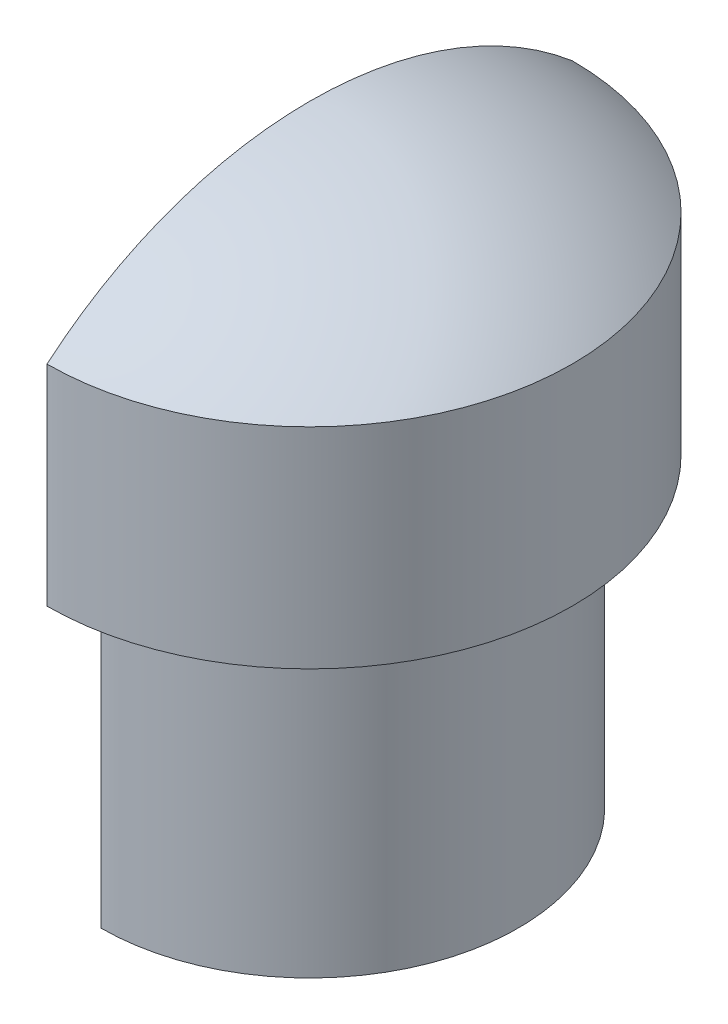
from build123d import *

# Parameters (mm, degrees)
SKETCH1_R           = 2.9
BOSS_EXTRUDE1_DEPTH = 5
CUT_EXTRUDE1_REACH  = 8.467
SKETCH2_R           = 1.4
CUT_EXTRUDE2_REACH  = 11.945
SKETCH8_W           = 3.65
SKETCH8_H           = 7.3


with BuildPart() as part:
    # Sketch1 → Boss-Extrude1 (new body)
    with BuildSketch(Plane(origin=(0, 0, 0), x_dir=(1, 0, 0), z_dir=(0, 1, 0))):
        with Locations(Location((0, 0, 0), (0, 0, 270))):
            Circle(SKETCH1_R)
    extrude(amount=BOSS_EXTRUDE1_DEPTH)

    # Sketch2 → Cut-Extrude1 (cut, up to next)
    with BuildSketch(Plane(origin=(0, 5, 0), x_dir=(1, 0, 0), z_dir=(0, 1, 0)), mode=Mode.PRIVATE) as cut_extrude1_sk1:
        with Locations(Location((0, 0, 0), (0, 0, 270))):
            Circle(SKETCH2_R)
    cut_extrude1_tool1 = extrude(cut_extrude1_sk1.sketch, amount=-CUT_EXTRUDE1_REACH, mode=Mode.PRIVATE) & part.part
    add(cut_extrude1_tool1.solids().sort_by_distance((0, 5, 0))[0], mode=Mode.SUBTRACT)

    # Sketch6 → Revolve2 (revolve)
    with BuildSketch(Plane.XY):
        with BuildLine():
            Line((2.9, 6.8), (2.9, 5))
            Line((2.9, 5), (2.9, 4.25))
            Line((2.9, 4.25), (3.65, 4.25))
            Line((3.65, 4.25), (3.65, 5))
            Line((3.65, 5), (3.65, 7.163179564))
            ThreePointArc((3.65, 7.163179564), (1.943552731, 8.155281325), (0, 8.5))
            Line((0, 8.5), (0, 7.75))
            ThreePointArc((0, 7.75), (1.525819452, 7.506448853), (2.9, 6.8))
        make_face()
    revolve(axis=Axis((0, 5, 0), (0, 1, 0)))

    # Sketch8 → Cut-Extrude2 (cut, up to next)
    with BuildSketch(Plane(origin=(0, 0, 0), x_dir=(1, 0, 0), z_dir=(0, 1, 0)), mode=Mode.PRIVATE) as cut_extrude2_sk1:
        with Locations((-1.825, 0)):
            Rectangle(SKETCH8_W, SKETCH8_H)
    cut_extrude2_tool1 = extrude(cut_extrude2_sk1.sketch, amount=CUT_EXTRUDE2_REACH, mode=Mode.PRIVATE) & part.part
    add(cut_extrude2_tool1.solids().sort_by_distance((-1.825, 0, 0))[0], mode=Mode.SUBTRACT)


solid = part.part
